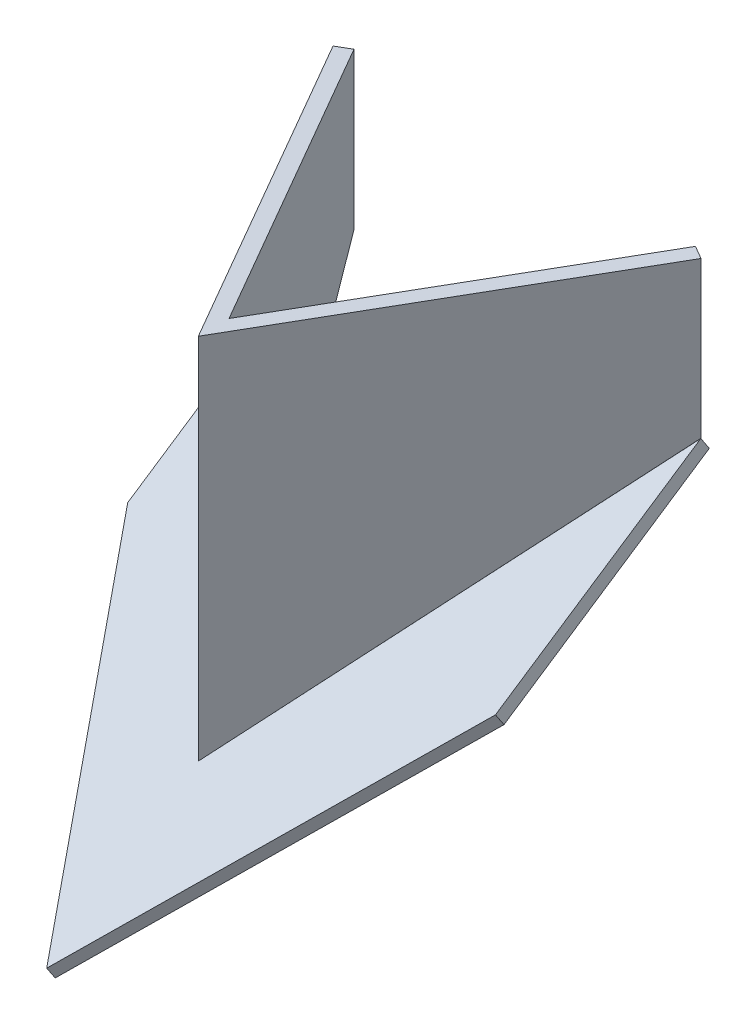
from build123d import *

# Parameters (mm, degrees)
EXTRUDE_THIN1_DEPTH     = 152.4
CUT_EXTRUDE1_DEPTH      = 218.484914533
CUT_EXTRUDE1_DEPTH_BACK = 218.484914533
CUT_EXTRUDE3_DEPTH      = 218.484914533
CUT_EXTRUDE3_DEPTH_BACK = 218.484914533
BOSS_EXTRUDE1_DEPTH     = 6.35


with BuildPart() as part:
    # Sketch1 → Extrude-Thin1 (new body)
    with BuildSketch(Plane(origin=(0, 0, 0), x_dir=(1, 0, 0), z_dir=(0, 1, 0))):
        Polygon((-76.2, 131.982271537), (0, 0), (76.2, 131.982271537), (70.700738686, 135.157271537), (0, 12.7), (-70.700738686, 135.157271537), align=None)
    extrude(amount=EXTRUDE_THIN1_DEPTH)

    # Sketch3 → Cut-Extrude1 (cut, two sides: drawn at the far end of the back side and taken through both)
    with BuildSketch(Plane(origin=(0, 0, 0), x_dir=(0.5000000000000046, 0, 0.8660254037844362), z_dir=(-0.8660254037844362, 0, 0.5000000000000046)).offset(-CUT_EXTRUDE1_DEPTH_BACK)):
        Polygon((385.619920401, -222.002507612), (0, 0), (-152.4, 87.73712241), (-538.019920401, 309.739630022), (-982.024935624, -461.500210779), (-58.385094823, -993.242348413), align=None)
    extrude(amount=CUT_EXTRUDE1_DEPTH + CUT_EXTRUDE1_DEPTH_BACK, mode=Mode.SUBTRACT)

    # Sketch2 → Cut-Extrude3 (cut, two sides: drawn at the far end of the back side and taken through both)
    with BuildSketch(Plane(origin=(0, 0, 0), x_dir=(0.49999999999999806, 0, -0.8660254037844397), z_dir=(0.8660254037844397, 0, 0.49999999999999806)).offset(-CUT_EXTRUDE3_DEPTH_BACK)):
        Polygon((152.4, 87.941634884), (0, 0), (152.4, 0), align=None)
    extrude(amount=CUT_EXTRUDE3_DEPTH + CUT_EXTRUDE3_DEPTH_BACK, mode=Mode.SUBTRACT)


with BuildPart() as body_2:
    # Sketch6 → Boss-Extrude1 (new body)
    with BuildSketch(Plane(origin=(0, 0, 0), x_dir=(-0.9999993759918608, -0.0009300055725387003, -0.0006189551875342996), z_dir=(0.0011171463150047337, -0.8324827103813286, -0.5540498974824092))):
        Polygon((-0.626924241, -76.2), (76.200047549, 56.338584839), (76.200047549, 158.483801703), (0, 0), (-76.200047549, 158.483801703), (-76.200047549, 56.338584839), align=None)
    extrude(amount=BOSS_EXTRUDE1_DEPTH)


solid = Compound([part.part, body_2.part])
